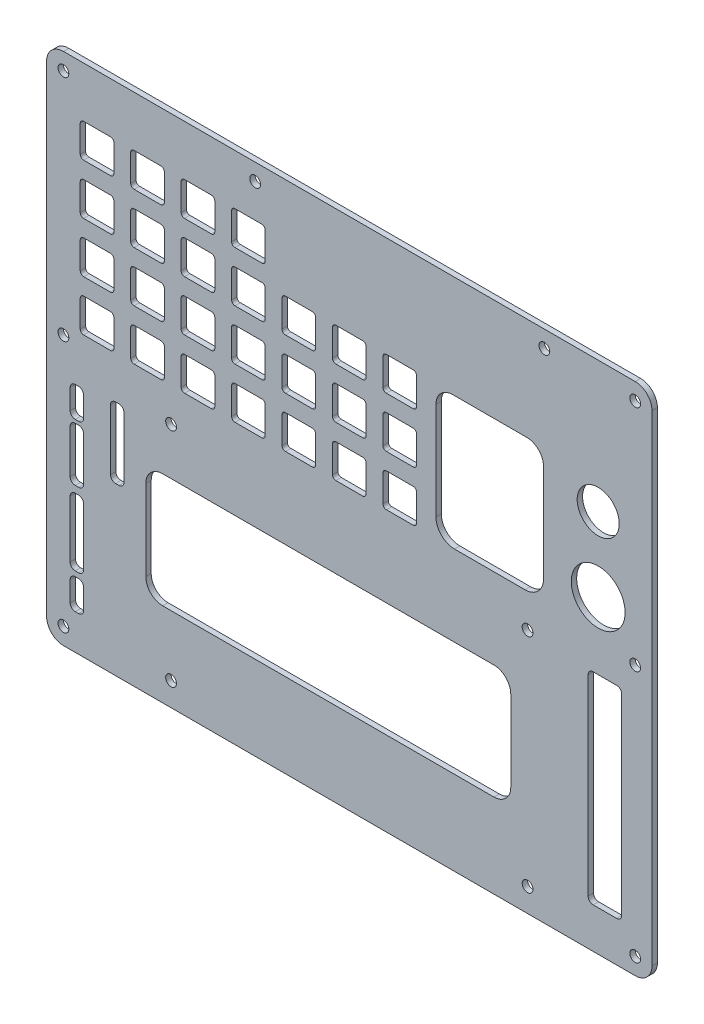
from build123d import *

# Parameters (mm, degrees)
SKETCH_1_R          = 1.6
EXTRUDE_1_DEPTH     = 1.6
CUT_EXTRUDE_1_REACH = 120.13
CUT_EXTRUDE_2_DEPTH = 1.6
CUT_EXTRUDE_3_REACH = 120.13
SKETCH_4_R          = 8
SKETCH_4_R_2        = 1.6
SKETCH_4_R_3        = 6.25
CUT_EXTRUDE_4_REACH = 120.13


with BuildPart() as part:
    # 草图1 → 凸台-拉伸1 (new body)
    with BuildSketch(Plane.XY):
        with BuildLine():
            Line((-85, 76.5), (85, 76.5))
            ThreePointArc((85, 76.5), (88.535533906, 75.035533906), (90, 71.5))
            Line((90, 71.5), (90, -71.5))
            ThreePointArc((90, -71.5), (88.535533906, -75.035533906), (85, -76.5))
            Line((85, -76.5), (-85, -76.5))
            ThreePointArc((-85, -76.5), (-88.535533906, -75.035533906), (-90, -71.5))
            Line((-90, -71.5), (-90, 71.5))
            ThreePointArc((-90, 71.5), (-88.535533906, 75.035533906), (-85, 76.5))
        make_face()
        with Locations((-85, 71.5)):
            Circle(SKETCH_1_R, mode=Mode.SUBTRACT)
        with Locations((85, 71.5)):
            Circle(SKETCH_1_R, mode=Mode.SUBTRACT)
        with Locations((85, -71.5)):
            Circle(SKETCH_1_R, mode=Mode.SUBTRACT)
        with Locations((-85, -71.5)):
            Circle(SKETCH_1_R, mode=Mode.SUBTRACT)
    extrude(amount=EXTRUDE_1_DEPTH)

    # 草图2 → 切除-拉伸1 (cut, up to next)
    with BuildSketch(Plane.XY.offset(1.6), mode=Mode.PRIVATE) as cut_extrude_1_sk1:
        with BuildLine():
            Line((30.75, 46), (52.75, 46))
            ThreePointArc((52.75, 46), (56.285533906, 44.535533906), (57.75, 41))
            Line((57.75, 41), (57.75, 12))
            ThreePointArc((57.75, 12), (56.139087297, 8.110912703), (52.25, 6.5))
            Line((52.25, 6.5), (31.25, 6.5))
            ThreePointArc((31.25, 6.5), (27.360912703, 8.110912703), (25.75, 12))
            Line((25.75, 12), (25.75, 41))
            ThreePointArc((25.75, 41), (27.214466094, 44.535533906), (30.75, 46))
        make_face()
    cut_extrude_1_tool1 = extrude(cut_extrude_1_sk1.sketch, amount=-CUT_EXTRUDE_1_REACH, mode=Mode.PRIVATE) & part.part
    add(cut_extrude_1_tool1.solids().sort_by_distance((41.75, 26.282683, 1.6))[0], mode=Mode.SUBTRACT)

    # 草图3 → 切除-拉伸2 (cut)
    with BuildSketch(Plane.XY.offset(1.6)):
        with BuildLine():
            Line((-80, 30.5), (-80, 22.5))
            ThreePointArc((-80, 22.5), (-79.707106781, 21.792893219), (-79, 21.5))
            Line((-79, 21.5), (-71, 21.5))
            ThreePointArc((-71, 21.5), (-70.292893219, 21.792893219), (-70, 22.5))
            Line((-70, 22.5), (-70, 30.5))
            ThreePointArc((-70, 30.5), (-70.292893219, 31.207106781), (-71, 31.5))
            Line((-71, 31.5), (-79, 31.5))
            ThreePointArc((-79, 31.5), (-79.707106781, 31.207106781), (-80, 30.5))
        make_face()
        with BuildLine():
            Line((-79, 16.5), (-71, 16.5))
            ThreePointArc((-71, 16.5), (-70.292893219, 16.207106781), (-70, 15.5))
            Line((-70, 15.5), (-70, 7.5))
            ThreePointArc((-70, 7.5), (-70.292893219, 6.792893219), (-71, 6.5))
            Line((-71, 6.5), (-79, 6.5))
            ThreePointArc((-79, 6.5), (-79.707106781, 6.792893219), (-80, 7.5))
            Line((-80, 7.5), (-80, 15.5))
            ThreePointArc((-80, 15.5), (-79.707106781, 16.207106781), (-79, 16.5))
        make_face()
        with BuildLine():
            Line((-80, 45.5), (-80, 37.5))
            ThreePointArc((-80, 37.5), (-79.707106781, 36.792893219), (-79, 36.5))
            Line((-79, 36.5), (-71, 36.5))
            ThreePointArc((-71, 36.5), (-70.292893219, 36.792893219), (-70, 37.5))
            Line((-70, 37.5), (-70, 45.5))
            ThreePointArc((-70, 45.5), (-70.292893219, 46.207106781), (-71, 46.5))
            Line((-71, 46.5), (-79, 46.5))
            ThreePointArc((-79, 46.5), (-79.707106781, 46.207106781), (-80, 45.5))
        make_face()
        with BuildLine():
            Line((-80, 60.5), (-80, 52.5))
            ThreePointArc((-80, 52.5), (-79.707106781, 51.792893219), (-79, 51.5))
            Line((-79, 51.5), (-71, 51.5))
            ThreePointArc((-71, 51.5), (-70.292893219, 51.792893219), (-70, 52.5))
            Line((-70, 52.5), (-70, 60.5))
            ThreePointArc((-70, 60.5), (-70.292893219, 61.207106781), (-71, 61.5))
            Line((-71, 61.5), (-79, 61.5))
            ThreePointArc((-79, 61.5), (-79.707106781, 61.207106781), (-80, 60.5))
        make_face()
        with BuildLine():
            Line((-64, 16.5), (-56, 16.5))
            ThreePointArc((-56, 16.5), (-55.292893219, 16.207106781), (-55, 15.5))
            Line((-55, 15.5), (-55, 7.5))
            ThreePointArc((-55, 7.5), (-55.292893219, 6.792893219), (-56, 6.5))
            Line((-56, 6.5), (-64, 6.5))
            ThreePointArc((-64, 6.5), (-64.707106781, 6.792893219), (-65, 7.5))
            Line((-65, 7.5), (-65, 15.5))
            ThreePointArc((-65, 15.5), (-64.707106781, 16.207106781), (-64, 16.5))
        make_face()
        with BuildLine():
            Line((-55, 30.5), (-55, 22.5))
            ThreePointArc((-55, 22.5), (-55.292893219, 21.792893219), (-56, 21.5))
            Line((-56, 21.5), (-64, 21.5))
            ThreePointArc((-64, 21.5), (-64.707106781, 21.792893219), (-65, 22.5))
            Line((-65, 22.5), (-65, 30.5))
            ThreePointArc((-65, 30.5), (-64.707106781, 31.207106781), (-64, 31.5))
            Line((-64, 31.5), (-56, 31.5))
            ThreePointArc((-56, 31.5), (-55.292893219, 31.207106781), (-55, 30.5))
        make_face()
        with BuildLine():
            Line((-64, 36.5), (-56, 36.5))
            ThreePointArc((-56, 36.5), (-55.292893219, 36.792893219), (-55, 37.5))
            Line((-55, 37.5), (-55, 45.5))
            ThreePointArc((-55, 45.5), (-55.292893219, 46.207106781), (-56, 46.5))
            Line((-56, 46.5), (-64, 46.5))
            ThreePointArc((-64, 46.5), (-64.707106781, 46.207106781), (-65, 45.5))
            Line((-65, 45.5), (-65, 37.5))
            ThreePointArc((-65, 37.5), (-64.707106781, 36.792893219), (-64, 36.5))
        make_face()
        with BuildLine():
            Line((-49, 16.5), (-41, 16.5))
            ThreePointArc((-41, 16.5), (-40.292893219, 16.207106781), (-40, 15.5))
            Line((-40, 15.5), (-40, 7.5))
            ThreePointArc((-40, 7.5), (-40.292893219, 6.792893219), (-41, 6.5))
            Line((-41, 6.5), (-49, 6.5))
            ThreePointArc((-49, 6.5), (-49.707106781, 6.792893219), (-50, 7.5))
            Line((-50, 7.5), (-50, 15.5))
            ThreePointArc((-50, 15.5), (-49.707106781, 16.207106781), (-49, 16.5))
        make_face()
        with BuildLine():
            Line((-40, 30.5), (-40, 22.5))
            ThreePointArc((-40, 22.5), (-40.292893219, 21.792893219), (-41, 21.5))
            Line((-41, 21.5), (-49, 21.5))
            ThreePointArc((-49, 21.5), (-49.707106781, 21.792893219), (-50, 22.5))
            Line((-50, 22.5), (-50, 30.5))
            ThreePointArc((-50, 30.5), (-49.707106781, 31.207106781), (-49, 31.5))
            Line((-49, 31.5), (-41, 31.5))
            ThreePointArc((-41, 31.5), (-40.292893219, 31.207106781), (-40, 30.5))
        make_face()
        with BuildLine():
            Line((-49, 36.5), (-41, 36.5))
            ThreePointArc((-41, 36.5), (-40.292893219, 36.792893219), (-40, 37.5))
            Line((-40, 37.5), (-40, 45.5))
            ThreePointArc((-40, 45.5), (-40.292893219, 46.207106781), (-41, 46.5))
            Line((-41, 46.5), (-49, 46.5))
            ThreePointArc((-49, 46.5), (-49.707106781, 46.207106781), (-50, 45.5))
            Line((-50, 45.5), (-50, 37.5))
            ThreePointArc((-50, 37.5), (-49.707106781, 36.792893219), (-49, 36.5))
        make_face()
        with BuildLine():
            Line((-34, 16.5), (-26, 16.5))
            ThreePointArc((-26, 16.5), (-25.292893219, 16.207106781), (-25, 15.5))
            Line((-25, 15.5), (-25, 7.5))
            ThreePointArc((-25, 7.5), (-25.292893219, 6.792893219), (-26, 6.5))
            Line((-26, 6.5), (-34, 6.5))
            ThreePointArc((-34, 6.5), (-34.707106781, 6.792893219), (-35, 7.5))
            Line((-35, 7.5), (-35, 15.5))
            ThreePointArc((-35, 15.5), (-34.707106781, 16.207106781), (-34, 16.5))
        make_face()
        with BuildLine():
            Line((-25, 30.5), (-25, 22.5))
            ThreePointArc((-25, 22.5), (-25.292893219, 21.792893219), (-26, 21.5))
            Line((-26, 21.5), (-34, 21.5))
            ThreePointArc((-34, 21.5), (-34.707106781, 21.792893219), (-35, 22.5))
            Line((-35, 22.5), (-35, 30.5))
            ThreePointArc((-35, 30.5), (-34.707106781, 31.207106781), (-34, 31.5))
            Line((-34, 31.5), (-26, 31.5))
            ThreePointArc((-26, 31.5), (-25.292893219, 31.207106781), (-25, 30.5))
        make_face()
        with BuildLine():
            Line((-34, 36.5), (-26, 36.5))
            ThreePointArc((-26, 36.5), (-25.292893219, 36.792893219), (-25, 37.5))
            Line((-25, 37.5), (-25, 45.5))
            ThreePointArc((-25, 45.5), (-25.292893219, 46.207106781), (-26, 46.5))
            Line((-26, 46.5), (-34, 46.5))
            ThreePointArc((-34, 46.5), (-34.707106781, 46.207106781), (-35, 45.5))
            Line((-35, 45.5), (-35, 37.5))
            ThreePointArc((-35, 37.5), (-34.707106781, 36.792893219), (-34, 36.5))
        make_face()
        with BuildLine():
            Line((-19, 16.5), (-11, 16.5))
            ThreePointArc((-11, 16.5), (-10.292893219, 16.207106781), (-10, 15.5))
            Line((-10, 15.5), (-10, 7.5))
            ThreePointArc((-10, 7.5), (-10.292893219, 6.792893219), (-11, 6.5))
            Line((-11, 6.5), (-19, 6.5))
            ThreePointArc((-19, 6.5), (-19.707106781, 6.792893219), (-20, 7.5))
            Line((-20, 7.5), (-20, 15.5))
            ThreePointArc((-20, 15.5), (-19.707106781, 16.207106781), (-19, 16.5))
        make_face()
        with BuildLine():
            Line((-10, 30.5), (-10, 22.5))
            ThreePointArc((-10, 22.5), (-10.292893219, 21.792893219), (-11, 21.5))
            Line((-11, 21.5), (-19, 21.5))
            ThreePointArc((-19, 21.5), (-19.707106781, 21.792893219), (-20, 22.5))
            Line((-20, 22.5), (-20, 30.5))
            ThreePointArc((-20, 30.5), (-19.707106781, 31.207106781), (-19, 31.5))
            Line((-19, 31.5), (-11, 31.5))
            ThreePointArc((-11, 31.5), (-10.292893219, 31.207106781), (-10, 30.5))
        make_face()
        with BuildLine():
            Line((-19, 36.5), (-11, 36.5))
            ThreePointArc((-11, 36.5), (-10.292893219, 36.792893219), (-10, 37.5))
            Line((-10, 37.5), (-10, 45.5))
            ThreePointArc((-10, 45.5), (-10.292893219, 46.207106781), (-11, 46.5))
            Line((-11, 46.5), (-19, 46.5))
            ThreePointArc((-19, 46.5), (-19.707106781, 46.207106781), (-20, 45.5))
            Line((-20, 45.5), (-20, 37.5))
            ThreePointArc((-20, 37.5), (-19.707106781, 36.792893219), (-19, 36.5))
        make_face()
        with BuildLine():
            Line((-4, 16.5), (4, 16.5))
            ThreePointArc((4, 16.5), (4.707106781, 16.207106781), (5, 15.5))
            Line((5, 15.5), (5, 7.5))
            ThreePointArc((5, 7.5), (4.707106781, 6.792893219), (4, 6.5))
            Line((4, 6.5), (-4, 6.5))
            ThreePointArc((-4, 6.5), (-4.707106781, 6.792893219), (-5, 7.5))
            Line((-5, 7.5), (-5, 15.5))
            ThreePointArc((-5, 15.5), (-4.707106781, 16.207106781), (-4, 16.5))
        make_face()
        with BuildLine():
            Line((5, 30.5), (5, 22.5))
            ThreePointArc((5, 22.5), (4.707106781, 21.792893219), (4, 21.5))
            Line((4, 21.5), (-4, 21.5))
            ThreePointArc((-4, 21.5), (-4.707106781, 21.792893219), (-5, 22.5))
            Line((-5, 22.5), (-5, 30.5))
            ThreePointArc((-5, 30.5), (-4.707106781, 31.207106781), (-4, 31.5))
            Line((-4, 31.5), (4, 31.5))
            ThreePointArc((4, 31.5), (4.707106781, 31.207106781), (5, 30.5))
        make_face()
        with BuildLine():
            Line((-4, 36.5), (4, 36.5))
            ThreePointArc((4, 36.5), (4.707106781, 36.792893219), (5, 37.5))
            Line((5, 37.5), (5, 45.5))
            ThreePointArc((5, 45.5), (4.707106781, 46.207106781), (4, 46.5))
            Line((4, 46.5), (-4, 46.5))
            ThreePointArc((-4, 46.5), (-4.707106781, 46.207106781), (-5, 45.5))
            Line((-5, 45.5), (-5, 37.5))
            ThreePointArc((-5, 37.5), (-4.707106781, 36.792893219), (-4, 36.5))
        make_face()
        with BuildLine():
            Line((11, 16.5), (19, 16.5))
            ThreePointArc((19, 16.5), (19.707106781, 16.207106781), (20, 15.5))
            Line((20, 15.5), (20, 7.5))
            ThreePointArc((20, 7.5), (19.707106781, 6.792893219), (19, 6.5))
            Line((19, 6.5), (11, 6.5))
            ThreePointArc((11, 6.5), (10.292893219, 6.792893219), (10, 7.5))
            Line((10, 7.5), (10, 15.5))
            ThreePointArc((10, 15.5), (10.292893219, 16.207106781), (11, 16.5))
        make_face()
        with BuildLine():
            Line((20, 30.5), (20, 22.5))
            ThreePointArc((20, 22.5), (19.707106781, 21.792893219), (19, 21.5))
            Line((19, 21.5), (11, 21.5))
            ThreePointArc((11, 21.5), (10.292893219, 21.792893219), (10, 22.5))
            Line((10, 22.5), (10, 30.5))
            ThreePointArc((10, 30.5), (10.292893219, 31.207106781), (11, 31.5))
            Line((11, 31.5), (19, 31.5))
            ThreePointArc((19, 31.5), (19.707106781, 31.207106781), (20, 30.5))
        make_face()
        with BuildLine():
            Line((11, 36.5), (19, 36.5))
            ThreePointArc((19, 36.5), (19.707106781, 36.792893219), (20, 37.5))
            Line((20, 37.5), (20, 45.5))
            ThreePointArc((20, 45.5), (19.707106781, 46.207106781), (19, 46.5))
            Line((19, 46.5), (11, 46.5))
            ThreePointArc((11, 46.5), (10.292893219, 46.207106781), (10, 45.5))
            Line((10, 45.5), (10, 37.5))
            ThreePointArc((10, 37.5), (10.292893219, 36.792893219), (11, 36.5))
        make_face()
        with BuildLine():
            Line((-64, 51.5), (-56, 51.5))
            ThreePointArc((-56, 51.5), (-55.292893219, 51.792893219), (-55, 52.5))
            Line((-55, 52.5), (-55, 60.5))
            ThreePointArc((-55, 60.5), (-55.292893219, 61.207106781), (-56, 61.5))
            Line((-56, 61.5), (-64, 61.5))
            ThreePointArc((-64, 61.5), (-64.707106781, 61.207106781), (-65, 60.5))
            Line((-65, 60.5), (-65, 52.5))
            ThreePointArc((-65, 52.5), (-64.707106781, 51.792893219), (-64, 51.5))
        make_face()
        with BuildLine():
            Line((-49, 51.5), (-41, 51.5))
            ThreePointArc((-41, 51.5), (-40.292893219, 51.792893219), (-40, 52.5))
            Line((-40, 52.5), (-40, 60.5))
            ThreePointArc((-40, 60.5), (-40.292893219, 61.207106781), (-41, 61.5))
            Line((-41, 61.5), (-49, 61.5))
            ThreePointArc((-49, 61.5), (-49.707106781, 61.207106781), (-50, 60.5))
            Line((-50, 60.5), (-50, 52.5))
            ThreePointArc((-50, 52.5), (-49.707106781, 51.792893219), (-49, 51.5))
        make_face()
        with BuildLine():
            Line((-34, 51.5), (-26, 51.5))
            ThreePointArc((-26, 51.5), (-25.292893219, 51.792893219), (-25, 52.5))
            Line((-25, 52.5), (-25, 60.5))
            ThreePointArc((-25, 60.5), (-25.292893219, 61.207106781), (-26, 61.5))
            Line((-26, 61.5), (-34, 61.5))
            ThreePointArc((-34, 61.5), (-34.707106781, 61.207106781), (-35, 60.5))
            Line((-35, 60.5), (-35, 52.5))
            ThreePointArc((-35, 52.5), (-34.707106781, 51.792893219), (-34, 51.5))
        make_face()
    extrude(amount=-CUT_EXTRUDE_2_DEPTH, mode=Mode.SUBTRACT)

    # 草图4 → 切除-拉伸3 (cut, up to next)
    with BuildSketch(Plane.XY.offset(1.6), mode=Mode.PRIVATE) as cut_extrude_3_sk1:
        with Locations((74, 15.5)):
            Circle(SKETCH_4_R)
    cut_extrude_3_tool1 = extrude(cut_extrude_3_sk1.sketch, amount=-CUT_EXTRUDE_3_REACH, mode=Mode.PRIVATE) & part.part
    # 草图4 → 切除-拉伸3 (cut, up to next)
    with BuildSketch(Plane.XY.offset(1.6), mode=Mode.PRIVATE) as cut_extrude_3_sk2:
        with Locations((-85, 3.5)):
            Circle(SKETCH_4_R_2)
    cut_extrude_3_tool2 = extrude(cut_extrude_3_sk2.sketch, amount=-CUT_EXTRUDE_3_REACH, mode=Mode.PRIVATE) & part.part
    # 草图4 → 切除-拉伸3 (cut, up to next)
    with BuildSketch(Plane.XY.offset(1.6), mode=Mode.PRIVATE) as cut_extrude_3_sk3:
        with Locations((-53, -69.5)):
            Circle(SKETCH_4_R_2)
    cut_extrude_3_tool3 = extrude(cut_extrude_3_sk3.sketch, amount=-CUT_EXTRUDE_3_REACH, mode=Mode.PRIVATE) & part.part
    # 草图4 → 切除-拉伸3 (cut, up to next)
    with BuildSketch(Plane.XY.offset(1.6), mode=Mode.PRIVATE) as cut_extrude_3_sk4:
        with Locations((-53, -3.5)):
            Circle(SKETCH_4_R_2)
    cut_extrude_3_tool4 = extrude(cut_extrude_3_sk4.sketch, amount=-CUT_EXTRUDE_3_REACH, mode=Mode.PRIVATE) & part.part
    # 草图4 → 切除-拉伸3 (cut, up to next)
    with BuildSketch(Plane.XY.offset(1.6), mode=Mode.PRIVATE) as cut_extrude_3_sk5:
        with Locations((53, -3.5)):
            Circle(SKETCH_4_R_2)
    cut_extrude_3_tool5 = extrude(cut_extrude_3_sk5.sketch, amount=-CUT_EXTRUDE_3_REACH, mode=Mode.PRIVATE) & part.part
    # 草图4 → 切除-拉伸3 (cut, up to next)
    with BuildSketch(Plane.XY.offset(1.6), mode=Mode.PRIVATE) as cut_extrude_3_sk6:
        with Locations((53, -69.5)):
            Circle(SKETCH_4_R_2)
    cut_extrude_3_tool6 = extrude(cut_extrude_3_sk6.sketch, amount=-CUT_EXTRUDE_3_REACH, mode=Mode.PRIVATE) & part.part
    # 草图4 → 切除-拉伸3 (cut, up to next)
    with BuildSketch(Plane.XY.offset(1.6), mode=Mode.PRIVATE) as cut_extrude_3_sk7:
        with Locations((74, 37.5)):
            Circle(SKETCH_4_R_3)
    cut_extrude_3_tool7 = extrude(cut_extrude_3_sk7.sketch, amount=-CUT_EXTRUDE_3_REACH, mode=Mode.PRIVATE) & part.part
    # 草图4 → 切除-拉伸3 (cut, up to next)
    with BuildSketch(Plane.XY.offset(1.6), mode=Mode.PRIVATE) as cut_extrude_3_sk8:
        with Locations((85, 3.5)):
            Circle(SKETCH_4_R_2)
    cut_extrude_3_tool8 = extrude(cut_extrude_3_sk8.sketch, amount=-CUT_EXTRUDE_3_REACH, mode=Mode.PRIVATE) & part.part
    # 草图4 → 切除-拉伸3 (cut, up to next)
    with BuildSketch(Plane.XY.offset(1.6), mode=Mode.PRIVATE) as cut_extrude_3_sk9:
        with Locations((-28, 71.5)):
            Circle(SKETCH_4_R_2)
    cut_extrude_3_tool9 = extrude(cut_extrude_3_sk9.sketch, amount=-CUT_EXTRUDE_3_REACH, mode=Mode.PRIVATE) & part.part
    # 草图4 → 切除-拉伸3 (cut, up to next)
    with BuildSketch(Plane.XY.offset(1.6), mode=Mode.PRIVATE) as cut_extrude_3_sk10:
        with Locations((58, 71.5)):
            Circle(SKETCH_4_R_2)
    cut_extrude_3_tool10 = extrude(cut_extrude_3_sk10.sketch, amount=-CUT_EXTRUDE_3_REACH, mode=Mode.PRIVATE) & part.part
    # 草图4 → 切除-拉伸3 (cut, up to next)
    with BuildSketch(Plane.XY.offset(1.6), mode=Mode.PRIVATE) as cut_extrude_3_sk11:
        with BuildLine():
            Line((-55.5, -51.5), (43, -51.5))
            ThreePointArc((43, -51.5), (46.535533906, -50.035533906), (48, -46.5))
            Line((48, -46.5), (48, -22.5))
            ThreePointArc((48, -22.5), (46.535533906, -18.964466094), (43, -17.5))
            Line((43, -17.5), (-55.5, -17.5))
            ThreePointArc((-55.5, -17.5), (-59.035533906, -18.964466094), (-60.5, -22.5))
            Line((-60.5, -22.5), (-60.5, -46.5))
            ThreePointArc((-60.5, -46.5), (-59.035533906, -50.035533906), (-55.5, -51.5))
        make_face()
    cut_extrude_3_tool11 = extrude(cut_extrude_3_sk11.sketch, amount=-CUT_EXTRUDE_3_REACH, mode=Mode.PRIVATE) & part.part
    add(cut_extrude_3_tool1.solids().sort_by_distance((74, 15.5, 1.6))[0], mode=Mode.SUBTRACT)
    add(cut_extrude_3_tool2.solids().sort_by_distance((-85, 3.5, 1.6))[0], mode=Mode.SUBTRACT)
    add(cut_extrude_3_tool3.solids().sort_by_distance((-53, -69.5, 1.6))[0], mode=Mode.SUBTRACT)
    add(cut_extrude_3_tool4.solids().sort_by_distance((-53, -3.5, 1.6))[0], mode=Mode.SUBTRACT)
    add(cut_extrude_3_tool5.solids().sort_by_distance((53, -3.5, 1.6))[0], mode=Mode.SUBTRACT)
    add(cut_extrude_3_tool6.solids().sort_by_distance((53, -69.5, 1.6))[0], mode=Mode.SUBTRACT)
    add(cut_extrude_3_tool7.solids().sort_by_distance((74, 37.5, 1.6))[0], mode=Mode.SUBTRACT)
    add(cut_extrude_3_tool8.solids().sort_by_distance((85, 3.5, 1.6))[0], mode=Mode.SUBTRACT)
    add(cut_extrude_3_tool9.solids().sort_by_distance((-28, 71.5, 1.6))[0], mode=Mode.SUBTRACT)
    add(cut_extrude_3_tool10.solids().sort_by_distance((58, 71.5, 1.6))[0], mode=Mode.SUBTRACT)
    add(cut_extrude_3_tool11.solids().sort_by_distance((-6.25, -34.5, 1.6))[0], mode=Mode.SUBTRACT)

    # 草图5 → 切除-拉伸4 (cut, up to next)
    with BuildSketch(Plane.XY.offset(1.6), mode=Mode.PRIVATE) as cut_extrude_4_sk1:
        with BuildLine():
            Line((79.5, -64.5), (72.5, -64.5))
            ThreePointArc((72.5, -64.5), (71.439339828, -64.060660172), (71, -63))
            Line((71, -63), (71, -6))
            ThreePointArc((71, -6), (71.439339828, -4.939339828), (72.5, -4.5))
            Line((72.5, -4.5), (79.5, -4.5))
            ThreePointArc((79.5, -4.5), (80.560660172, -4.939339828), (81, -6))
            Line((81, -6), (81, -63))
            ThreePointArc((81, -63), (80.560660172, -64.060660172), (79.5, -64.5))
        make_face()
    cut_extrude_4_tool1 = extrude(cut_extrude_4_sk1.sketch, amount=-CUT_EXTRUDE_4_REACH, mode=Mode.PRIVATE) & part.part
    # 草图5 → 切除-拉伸4 (cut, up to next)
    with BuildSketch(Plane.XY.offset(1.6), mode=Mode.PRIVATE) as cut_extrude_4_sk2:
        with BuildLine():
            Line((-81.5, -66), (-80.5, -66))
            ThreePointArc((-80.5, -66), (-79.439339828, -65.560660172), (-79, -64.5))
            Line((-79, -64.5), (-79, -58.5))
            ThreePointArc((-79, -58.5), (-79.439339828, -57.439339828), (-80.5, -57))
            Line((-80.5, -57), (-81.5, -57))
            ThreePointArc((-81.5, -57), (-82.560660172, -57.439339828), (-83, -58.5))
            Line((-83, -58.5), (-83, -64.5))
            ThreePointArc((-83, -64.5), (-82.560660172, -65.560660172), (-81.5, -66))
        make_face()
    cut_extrude_4_tool2 = extrude(cut_extrude_4_sk2.sketch, amount=-CUT_EXTRUDE_4_REACH, mode=Mode.PRIVATE) & part.part
    # 草图5 → 切除-拉伸4 (cut, up to next)
    with BuildSketch(Plane.XY.offset(1.6), mode=Mode.PRIVATE) as cut_extrude_4_sk3:
        with BuildLine():
            Line((-81.5, -55.5), (-80.5, -55.5))
            ThreePointArc((-80.5, -55.5), (-79.439339828, -55.060660172), (-79, -54))
            Line((-79, -54), (-79, -37))
            ThreePointArc((-79, -37), (-79.439339828, -35.939339828), (-80.5, -35.5))
            Line((-80.5, -35.5), (-81.5, -35.5))
            ThreePointArc((-81.5, -35.5), (-82.560660172, -35.939339828), (-83, -37))
            Line((-83, -37), (-83, -54))
            ThreePointArc((-83, -54), (-82.560660172, -55.060660172), (-81.5, -55.5))
        make_face()
    cut_extrude_4_tool3 = extrude(cut_extrude_4_sk3.sketch, amount=-CUT_EXTRUDE_4_REACH, mode=Mode.PRIVATE) & part.part
    # 草图5 → 切除-拉伸4 (cut, up to next)
    with BuildSketch(Plane.XY.offset(1.6), mode=Mode.PRIVATE) as cut_extrude_4_sk4:
        with BuildLine():
            Line((-81.5, -33.5), (-80.5, -33.5))
            ThreePointArc((-80.5, -33.5), (-79.439339828, -33.060660172), (-79, -32))
            Line((-79, -32), (-79, -19))
            ThreePointArc((-79, -19), (-79.439339828, -17.939339828), (-80.5, -17.5))
            Line((-80.5, -17.5), (-81.5, -17.5))
            ThreePointArc((-81.5, -17.5), (-82.560660172, -17.939339828), (-83, -19))
            Line((-83, -19), (-83, -32))
            ThreePointArc((-83, -32), (-82.560660172, -33.060660172), (-81.5, -33.5))
        make_face()
    cut_extrude_4_tool4 = extrude(cut_extrude_4_sk4.sketch, amount=-CUT_EXTRUDE_4_REACH, mode=Mode.PRIVATE) & part.part
    # 草图5 → 切除-拉伸4 (cut, up to next)
    with BuildSketch(Plane.XY.offset(1.6), mode=Mode.PRIVATE) as cut_extrude_4_sk5:
        with BuildLine():
            Line((-81.5, -16.5), (-80.5, -16.5))
            ThreePointArc((-80.5, -16.5), (-79.439339828, -16.060660172), (-79, -15))
            Line((-79, -15), (-79, -9))
            ThreePointArc((-79, -9), (-79.439339828, -7.939339828), (-80.5, -7.5))
            Line((-80.5, -7.5), (-81.5, -7.5))
            ThreePointArc((-81.5, -7.5), (-82.560660172, -7.939339828), (-83, -9))
            Line((-83, -9), (-83, -15))
            ThreePointArc((-83, -15), (-82.560660172, -16.060660172), (-81.5, -16.5))
        make_face()
    cut_extrude_4_tool5 = extrude(cut_extrude_4_sk5.sketch, amount=-CUT_EXTRUDE_4_REACH, mode=Mode.PRIVATE) & part.part
    # 草图5 → 切除-拉伸4 (cut, up to next)
    with BuildSketch(Plane.XY.offset(1.6), mode=Mode.PRIVATE) as cut_extrude_4_sk6:
        with BuildLine():
            Line((-69.5, -27), (-68.5, -27))
            ThreePointArc((-68.5, -27), (-67.439339828, -26.560660172), (-67, -25.5))
            Line((-67, -25.5), (-67, -7.5))
            ThreePointArc((-67, -7.5), (-67.439339828, -6.439339828), (-68.5, -6))
            Line((-68.5, -6), (-69.5, -6))
            ThreePointArc((-69.5, -6), (-70.560660172, -6.439339828), (-71, -7.5))
            Line((-71, -7.5), (-71, -25.5))
            ThreePointArc((-71, -25.5), (-70.560660172, -26.560660172), (-69.5, -27))
        make_face()
    cut_extrude_4_tool6 = extrude(cut_extrude_4_sk6.sketch, amount=-CUT_EXTRUDE_4_REACH, mode=Mode.PRIVATE) & part.part
    add(cut_extrude_4_tool1.solids().sort_by_distance((76, -34.5, 1.6))[0], mode=Mode.SUBTRACT)
    add(cut_extrude_4_tool2.solids().sort_by_distance((-81, -61.5, 1.6))[0], mode=Mode.SUBTRACT)
    add(cut_extrude_4_tool3.solids().sort_by_distance((-81, -45.5, 1.6))[0], mode=Mode.SUBTRACT)
    add(cut_extrude_4_tool4.solids().sort_by_distance((-81, -25.5, 1.6))[0], mode=Mode.SUBTRACT)
    add(cut_extrude_4_tool5.solids().sort_by_distance((-81, -12, 1.6))[0], mode=Mode.SUBTRACT)
    add(cut_extrude_4_tool6.solids().sort_by_distance((-69, -16.5, 1.6))[0], mode=Mode.SUBTRACT)


solid = part.part
